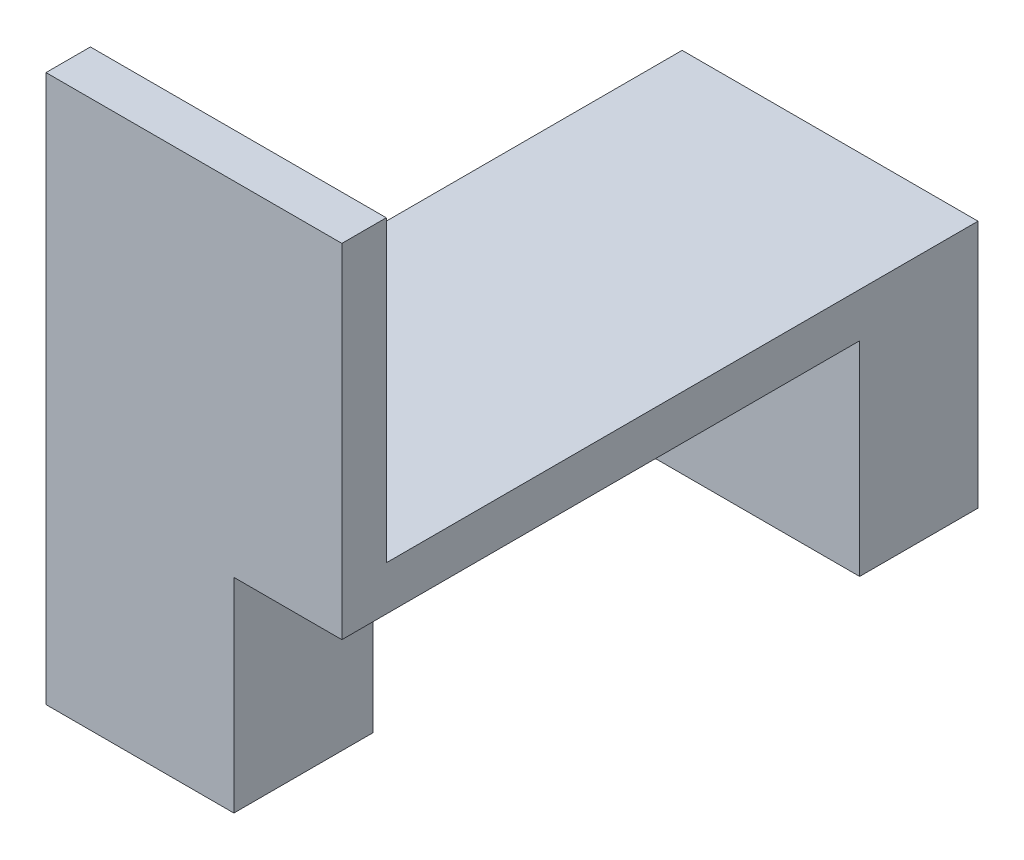
from build123d import *

# Parameters (mm, degrees)
EXTRUDE_3_DEPTH     = 10
SKETCH_4_W          = 2.5
SKETCH_4_H          = 21.5
EXTRUDE_4_DEPTH     = 1.5
SKETCH_5_R          = 0.85
EXTRUDE_5_DEPTH     = 6.9
CUT_EXTRUDE_START   = 2
SKETCH_6_W          = 3.85
SKETCH_6_H          = 12.8
CUT_EXTRUDE_1_DEPTH = 25.397158938


with BuildPart() as part:
    # Эскиз3 → Бобышка-Вытянуть3 (new body)
    with BuildSketch(Plane(origin=(0, 0, 0), x_dir=(0, 0, -1), z_dir=(1, 0, 0))):
        Polygon((0, 0), (-21.5, 0), (-21.5, 11.6), (-20, 11.6), (-20, 1.5), (0, 1.5), align=None)
    extrude(amount=-EXTRUDE_3_DEPTH)

    # Эскиз4 → Бобышка-Вытянуть4 (add)
    with BuildSketch(Plane(origin=(0, 0, 0), x_dir=(1, 0, 0), z_dir=(0, 1, 0))):
        with Locations((-8.75, -10.75)):
            Rectangle(SKETCH_4_W, SKETCH_4_H)
    extrude(amount=-EXTRUDE_4_DEPTH)

    # Эскиз5 → Бобышка-Вытянуть5 (add)
    with BuildSketch(Plane(origin=(0, 0, 0), x_dir=(1, 0, 0), z_dir=(0, 1, 0))):
        with Locations(Location((-5.8, -7.15, 0), (0, 0, 270))):
            Circle(SKETCH_5_R)
        with Locations(Location((-5.8, -13.65, 0), (0, 0, 270))):
            Circle(SKETCH_5_R)
        Polygon((-7.5, 0), (-3.65, 0), (0, 0), (0, -4), (-3.65, -4), (-7.5, -4), (-7.5, -4.75), (-10, -4.75), (-10, 0), align=None)
        Polygon((-7.5, -21.5), (-3.65, -21.5), (-3.65, -16.8), (-7.5, -16.8), (-7.5, -16.05), (-10, -16.05), (-10, -21.5), align=None)
    extrude(amount=-EXTRUDE_5_DEPTH)

    # Эскиз6 → Вырез-Вытянуть1 (cut, through all)
    with BuildSketch(Plane.XZ.offset(CUT_EXTRUDE_START)):
        with Locations((-5.575, 10.4)):
            Rectangle(SKETCH_6_W, SKETCH_6_H)
    extrude(amount=CUT_EXTRUDE_1_DEPTH, mode=Mode.SUBTRACT)


solid = part.part
